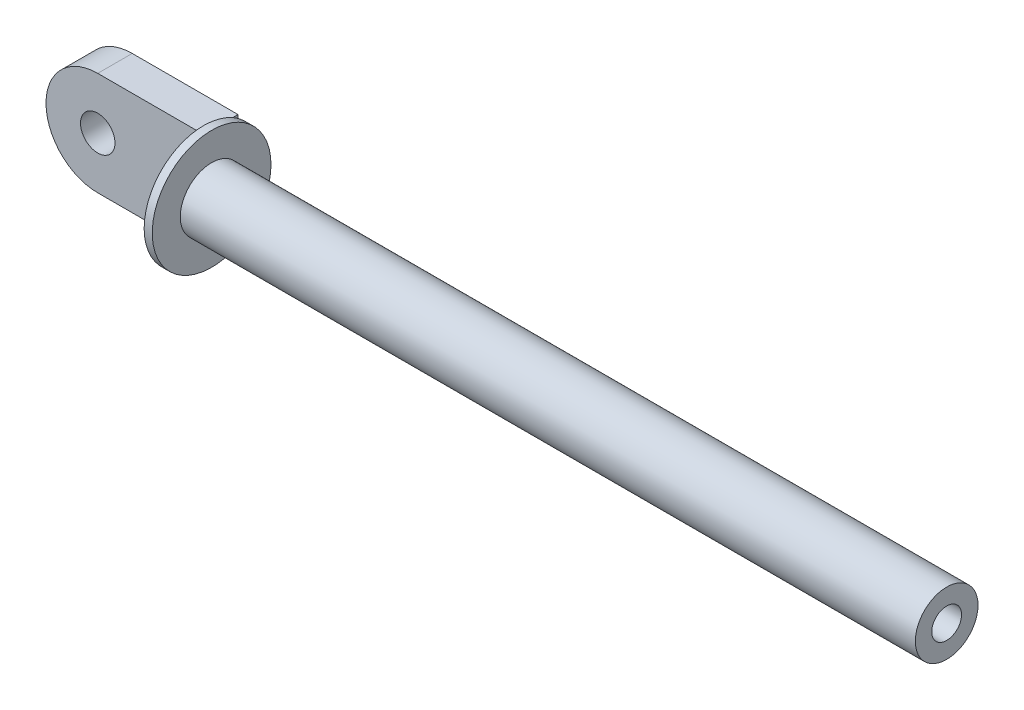
from build123d import *

# Parameters (mm, degrees)
SKETCH1_R           = 5
BOSS_EXTRUDE1_DEPTH = 5


with BuildPart() as part:
    # Sketch1 → Boss-Extrude1 (new, symmetric)
    with BuildSketch(Plane.XY):
        with BuildLine():
            Line((-83.738010361, 45.784514601), (-53.074190666, 45.784514601))
            Line((-53.074190666, 45.784514601), (-53.074190666, 15.784514601))
            Line((-53.074190666, 15.784514601), (-83.738010361, 15.784514601))
            ThreePointArc((-83.738010361, 15.784514601), (-98.738010361, 30.784514601), (-83.738010361, 45.784514601))
        make_face()
        with Locations((-83.738010361, 30.784514601)):
            Circle(SKETCH1_R, mode=Mode.SUBTRACT)
    extrude(amount=BOSS_EXTRUDE1_DEPTH, both=True)

    # Sketch2 → Revolve1 (revolve)
    with BuildSketch(Plane.XY.offset(5), mode=Mode.PRIVATE) as revolve1_sk:
        Polygon((-53.074190666, 45.784514601), (-53.074190666, 47.99778913), (-50.728429203, 47.99778913), (-50.728429203, 39.869151099), (162.360473408, 39.869151099), (162.360473408, 35.107489348), (-48.658763898, 35.107489348), (-48.658763898, 30.784514601), (-53.074190666, 30.784514601), align=None)
    revolve(revolve1_sk.sketch.rotate(Axis((-48.658763898, 30.784514601, 5), (-1, 0, 0)), 90), axis=Axis((-48.658763898, 30.784514601, 5), (-1, 0, 0)))


solid = part.part
